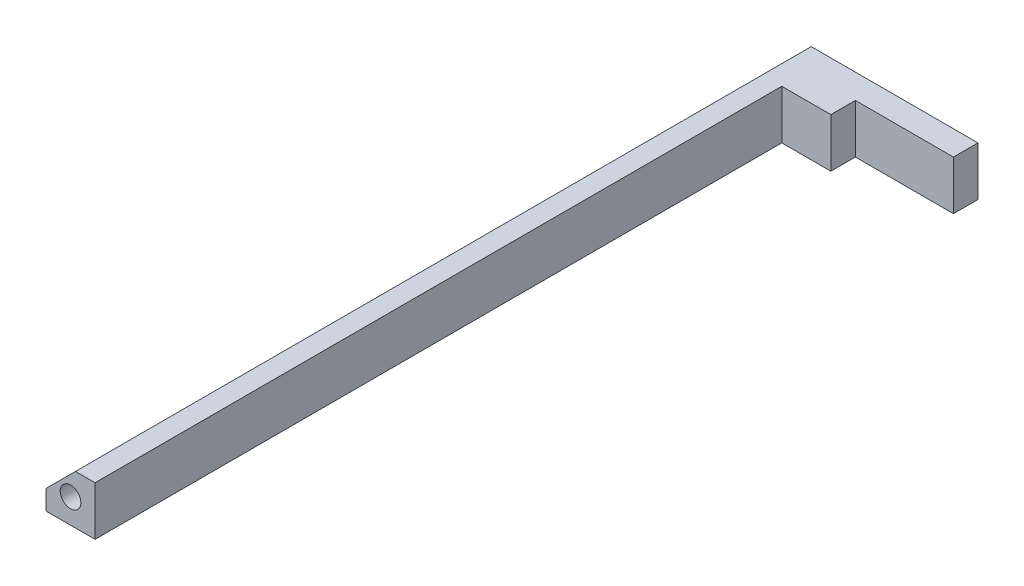
from build123d import *

# Parameters (mm, degrees)
DODANIE_WYCI_GNI_CIE1_DEPTH = 10
SZKIC2_R                    = 2.1
WYTNIJ_WYCI_GNI_CIE1_DEPTH  = 4
SZKIC3_R                    = 2.1
WYTNIJ_WYCI_GNI_CIE2_DEPTH  = 4
SFAZOWANIE1_SIZE            = 6


with BuildPart() as part:
    # Szkic1 → Dodanie-wyciągnięcie1 (new body)
    with BuildSketch(Plane(origin=(0, 0, 0), x_dir=(1, 0, 0), z_dir=(0, 1, 0))):
        Polygon((0, 0), (0, 150), (40, 150), (40, 145), (20, 145), (20, 140), (10, 140), (10, 0), align=None)
    extrude(amount=DODANIE_WYCI_GNI_CIE1_DEPTH)

    # Szkic2 → Wytnij-wyciągnięcie1 (cut)
    with BuildSketch(Plane.XZ):
        with Locations(Location((7.2, -27, 0), (0, 0, 270))):
            Circle(SZKIC2_R)
        with Locations(Location((7.2, -123, 0), (0, 0, 270))):
            Circle(SZKIC2_R)
    extrude(amount=-WYTNIJ_WYCI_GNI_CIE1_DEPTH, mode=Mode.SUBTRACT)

    # Szkic3 → Wytnij-wyciągnięcie2 (cut)
    with BuildSketch(Plane.XY):
        with Locations((5, 5)):
            Circle(SZKIC3_R)
    extrude(amount=-WYTNIJ_WYCI_GNI_CIE2_DEPTH, mode=Mode.SUBTRACT)

    # Sfazowanie1
    sfazowanie1_edges = [part.edges().sort_by_distance(p)[0] for p in [
        (0, 10, -75),
    ]]
    chamfer(sfazowanie1_edges, length=SFAZOWANIE1_SIZE)


solid = part.part
